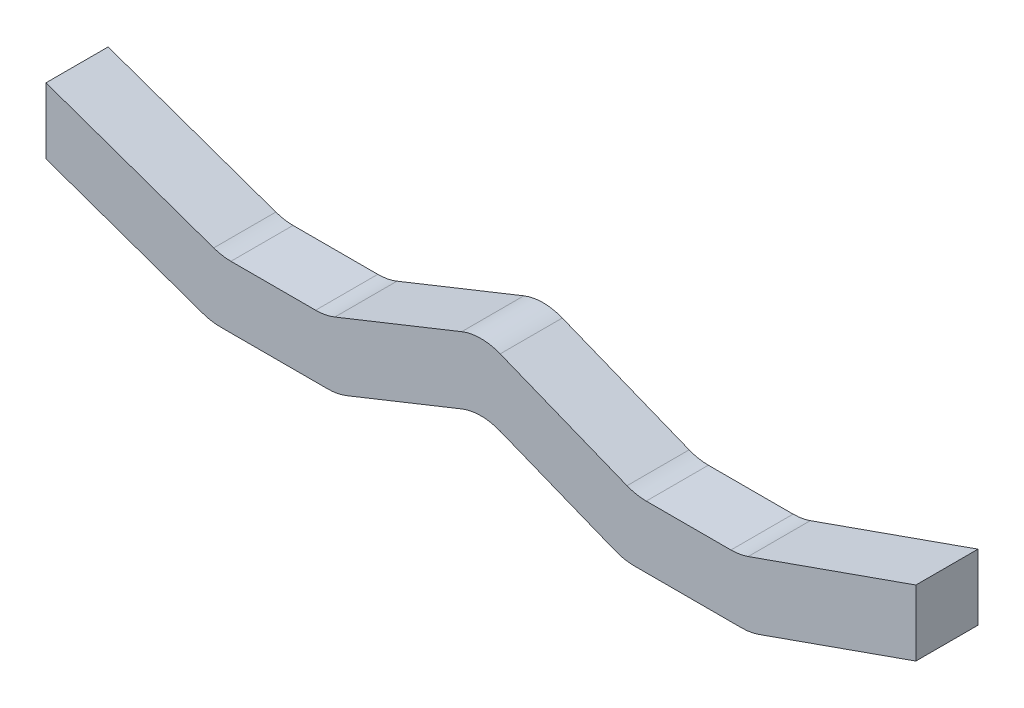
from build123d import *

# Parameters (mm, degrees)
BOSS_EXTRUDE1_DEPTH = 19.05
FILLET1_R           = 15.875


with BuildPart() as part:
    # Sketch1 → Boss-Extrude1 (new body)
    with BuildSketch(Plane.XY):
        Polygon((0, 0), (47.625, -19.05), (79.375, -19.05), (133.35, 0), (133.35, -20.201691705), (82.638126498, -38.1), (43.956305212, -38.1), (0, -20.517477915), (-43.956305212, -38.1), (-82.638126498, -38.1), (-133.35, -20.201691705), (-133.35, 0), (-79.375, -19.05), (-47.625, -19.05), align=None)
    extrude(amount=BOSS_EXTRUDE1_DEPTH)

    # Fillet1
    fillet1_edges = [part.edges().sort_by_distance(p)[0] for p in [
        (0, 0, 9.525),
        (47.625, -19.05, 9.525),
        (79.375, -19.05, 9.525),
        (82.638126498, -38.1, 9.525),
        (43.956305212, -38.1, 9.525),
        (0, -20.517477915, 9.525),
        (-43.956305212, -38.1, 9.525),
        (-82.638126498, -38.1, 9.525),
        (-79.375, -19.05, 9.525),
        (-47.625, -19.05, 9.525),
    ]]
    fillet(fillet1_edges, radius=FILLET1_R)


solid = part.part
